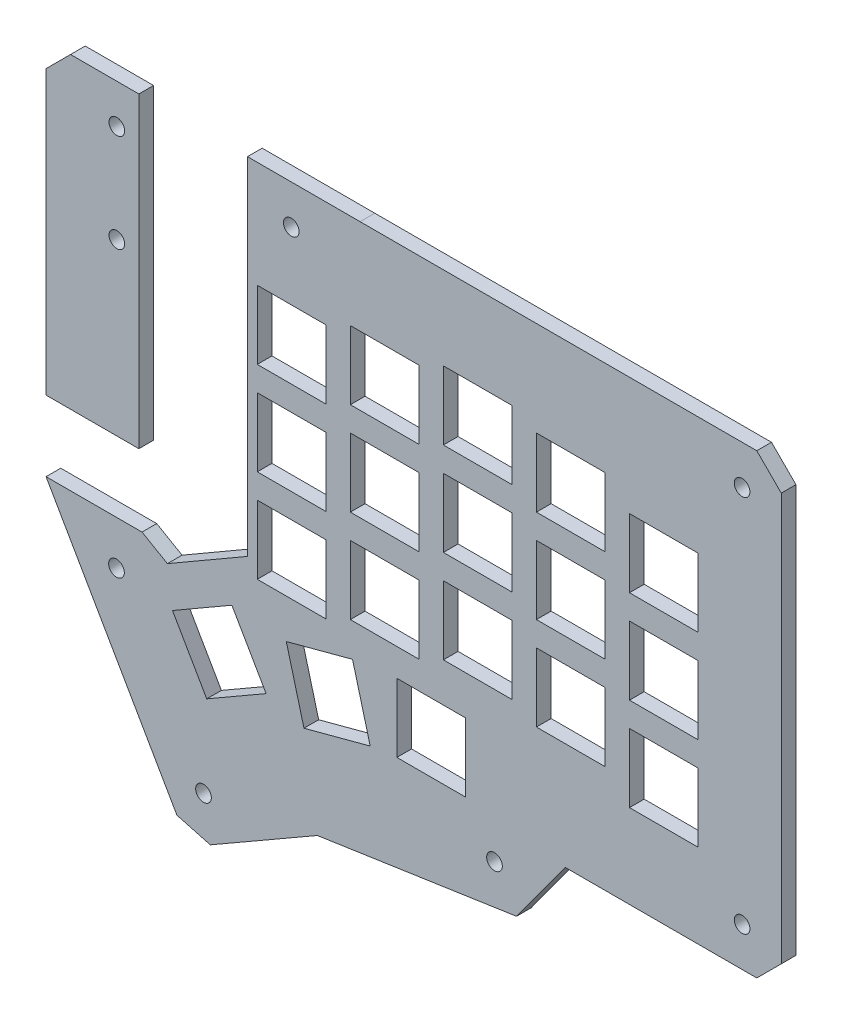
from build123d import *

# Parameters (mm, degrees)
SWITCHPLATE_R           = 1.6
SWITCHPLATE_W           = 14.000982373
SWITCHPLATE_H           = 14.000982374
SWITCHPLATE_H_2         = 14.000982373
SWITCHPLATE_W_2         = 14.000982374
BOSS_EXTRU_2_DEPTH      = 3
ESQUISSE1_W             = 20.456160795
ESQUISSE1_H             = 14.420470361
ENL_V_MAT_EXTRU_1_DEPTH = 10


with BuildPart() as part:
    # Switchplate → Boss.-Extru.2 (new body)
    with BuildSketch(Plane.XY):
        Polygon((-160.478985875, -70.841138967), (-133.761270027, -117.344044002), (-126.936961278, -119.18521524), (-105.07834936, -106.603969177), (-64.409664562, -100.558603138), (-54.463628843, -86.933633781), (-15.339106902, -86.933633781), (-10.339106902, -81.933633781), (-10.339106902, 1.31606909), (-15.339106894, 6.316347179), (-96.344426674, 6.320852512), (-103.340940531, 6.320852512), (-119.346315028, 6.320852512), (-119.346315028, 1.570515597), (-119.346630506, -64.372807463), (-135.694988334, -73.831500172), (-141.52282508, -70.47035259), (-141.52282508, 1.570515597), (-141.52282508, 6.320852512), (-155.478985875, 6.320852512), (-160.478985875, 1.320852512), (-160.478985875, -3.429484403), align=None)
        with Locations((-18.339106961, -1.684542717)):
            Circle(SWITCHPLATE_R, mode=Mode.SUBTRACT)
        with Locations((-110.397084988, -1.678365923)):
            Circle(SWITCHPLATE_R, mode=Mode.SUBTRACT)
        with Locations((-18.339106961, -78.933633781)):
            Circle(SWITCHPLATE_R, mode=Mode.SUBTRACT)
        with Locations((-68.897334865, -93.137788223)):
            Circle(SWITCHPLATE_R, mode=Mode.SUBTRACT)
        with Locations((-128.322250168, -110.752044388)):
            Circle(SWITCHPLATE_R, mode=Mode.SUBTRACT)
        with Locations((-146.0923789, -79.822656053)):
            Circle(SWITCHPLATE_R, mode=Mode.SUBTRACT)
        with Locations((-146.02282508, -1.677868186)):
            Circle(SWITCHPLATE_R, mode=Mode.SUBTRACT)
        with Locations((-146.02282508, -21.682390047)):
            Circle(SWITCHPLATE_R, mode=Mode.SUBTRACT)
        with Locations((-110.341431718, -22.42033468)):
            Rectangle(SWITCHPLATE_W, SWITCHPLATE_H, mode=Mode.SUBTRACT)
        with Locations((-91.340084057, -20.045166224)):
            Rectangle(SWITCHPLATE_W, SWITCHPLATE_H_2, mode=Mode.SUBTRACT)
        with Locations((-72.338736396, -17.669997767)):
            Rectangle(SWITCHPLATE_W_2, SWITCHPLATE_H, mode=Mode.SUBTRACT)
        with Locations((-53.337388735, -20.045166225)):
            Rectangle(SWITCHPLATE_W_2, SWITCHPLATE_H, mode=Mode.SUBTRACT)
        with Locations((-34.336041075, -24.795503141)):
            Rectangle(SWITCHPLATE_W_2, SWITCHPLATE_H, mode=Mode.SUBTRACT)
        with Locations((-110.341431718, -41.421682341)):
            Rectangle(SWITCHPLATE_W_2, SWITCHPLATE_H, mode=Mode.SUBTRACT)
        with Locations((-91.340084058, -39.046513884)):
            Rectangle(SWITCHPLATE_W, SWITCHPLATE_H, mode=Mode.SUBTRACT)
        with Locations((-72.338736397, -36.671345428)):
            Rectangle(SWITCHPLATE_W_2, SWITCHPLATE_H_2, mode=Mode.SUBTRACT)
        with Locations((-53.337388736, -39.046513886)):
            Rectangle(SWITCHPLATE_W_2, SWITCHPLATE_H, mode=Mode.SUBTRACT)
        with Locations((-34.336041076, -43.796850802)):
            Rectangle(SWITCHPLATE_W, SWITCHPLATE_H, mode=Mode.SUBTRACT)
        with Locations((-34.336041077, -62.798198463)):
            Rectangle(SWITCHPLATE_W, SWITCHPLATE_H, mode=Mode.SUBTRACT)
        with Locations((-53.337388737, -58.047861547)):
            Rectangle(SWITCHPLATE_W_2, SWITCHPLATE_H, mode=Mode.SUBTRACT)
        with Locations((-72.338736397, -55.672693088)):
            Rectangle(SWITCHPLATE_W, SWITCHPLATE_H, mode=Mode.SUBTRACT)
        with Locations((-91.340084058, -58.047861545)):
            Rectangle(SWITCHPLATE_W_2, SWITCHPLATE_H, mode=Mode.SUBTRACT)
        with Locations((-110.341431719, -60.423030002)):
            Rectangle(SWITCHPLATE_W_2, SWITCHPLATE_H, mode=Mode.SUBTRACT)
        with Locations((-81.839410229, -77.674253537)):
            Rectangle(SWITCHPLATE_W_2, SWITCHPLATE_H, mode=Mode.SUBTRACT)
        Polygon((-111.417520933, -75.466480675), (-97.889935794, -71.856501764), (-94.279956882, -85.384086902), (-107.807542021, -88.994065814), align=None, mode=Mode.SUBTRACT)
        Polygon((-134.658112592, -81.599723585), (-122.528132256, -74.607507592), (-115.535916264, -86.737487928), (-127.665896599, -93.729703921), align=None, mode=Mode.SUBTRACT)
    extrude(amount=BOSS_EXTRU_2_DEPTH)

    # Esquisse1 → Enlèv. mat.-Extru.1 (cut)
    with BuildSketch(Plane.XY.offset(3)):
        with Locations((-150.250905477, -63.630903787)):
            Rectangle(ESQUISSE1_W, ESQUISSE1_H)
    extrude(amount=-ENL_V_MAT_EXTRU_1_DEPTH, mode=Mode.SUBTRACT)


with BuildPart() as enl_v_mat_extru_1_piece_1:
    # of the separate pieces the step leaves, piece 1, a body of its own (enl_v_mat_extru_1_pieces)
    add(part.part.solids().sort_by_distance((-160.478985875, -70.841138967, 0))[0])


with BuildPart() as enl_v_mat_extru_1_piece_2:
    # of the separate pieces the step leaves, piece 2, a body of its own (enl_v_mat_extru_1_pieces)
    add(part.part.solids().sort_by_distance((-160.478985875, 1.320852512, 0))[0])


solid = Compound([enl_v_mat_extru_1_piece_1.part, enl_v_mat_extru_1_piece_2.part])
